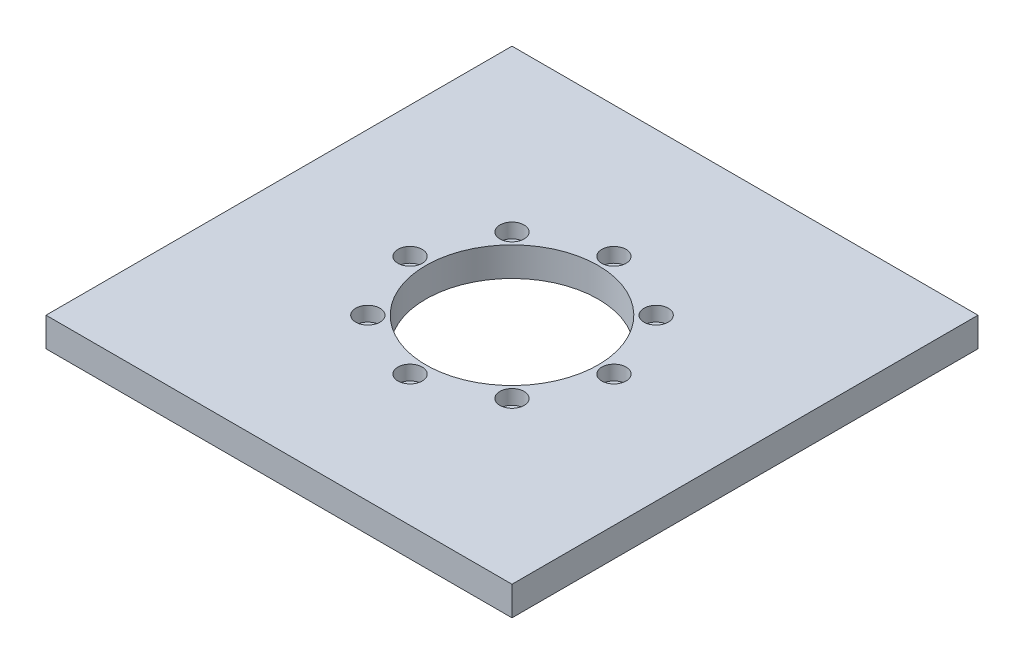
from build123d import *

# Parameters (mm, degrees)
SKETCH1_W                                        = 304.8
SKETCH1_H                                        = 304.8
SKETCH1_R                                        = 56.35625
BOSS_EXTRUDE1_DEPTH                              = 19.05
CBORE_FOR_3_8_SOCKET_HEAD_CAP_SCREW1_D           = 9.8044
CBORE_FOR_3_8_SOCKET_HEAD_CAP_SCREW1_CBORE_D     = 15.875
CBORE_FOR_3_8_SOCKET_HEAD_CAP_SCREW1_CBORE_DEPTH = 9.525


with BuildPart() as part:
    # Sketch1 → Boss-Extrude1 (new body)
    with BuildSketch(Plane(origin=(0, 0, 0), x_dir=(1, 0, 0), z_dir=(0, 1, 0))):
        Rectangle(SKETCH1_W, SKETCH1_H)
        with Locations(Location((0, 0, 0), (0, 0, 90))):
            Circle(SKETCH1_R, mode=Mode.SUBTRACT)
    extrude(amount=BOSS_EXTRUDE1_DEPTH)

    # CBORE for 3/8 Socket Head Cap Screw1 (through all)
    with Locations(Plane(origin=(0, 19.05, 0), x_dir=(1, 0, 0), z_dir=(0, 1, 0))):
        with Locations((47.146344636, -47.146344636), (66.675, 0), (47.146344636, 47.146344636), (0, 66.675), (-47.146344636, 47.146344636), (-66.675, 0), (-47.146344636, -47.146344636), (0, -66.675)):
            CounterBoreHole(CBORE_FOR_3_8_SOCKET_HEAD_CAP_SCREW1_D / 2, CBORE_FOR_3_8_SOCKET_HEAD_CAP_SCREW1_CBORE_D / 2, CBORE_FOR_3_8_SOCKET_HEAD_CAP_SCREW1_CBORE_DEPTH)


solid = part.part
